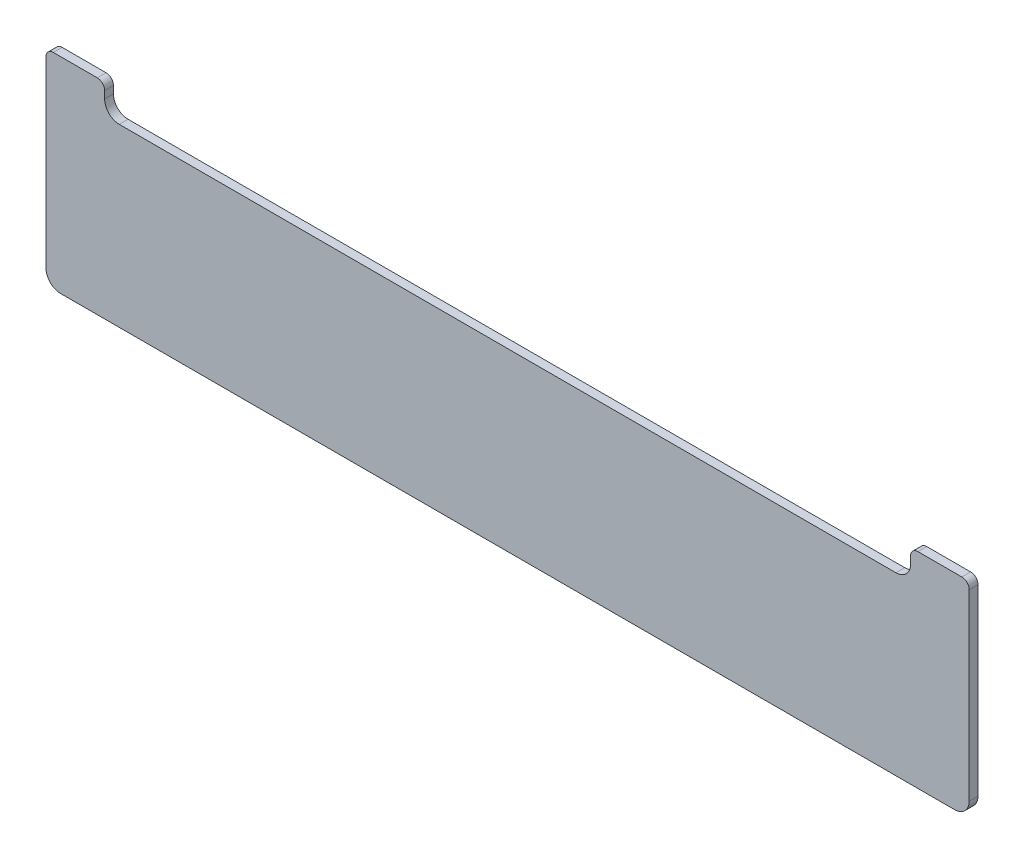
from build123d import *

# Parameters (mm, degrees)
SKETCH1_W           = 315
SKETCH1_H           = 70
BOSS_EXTRUDE1_DEPTH = 3
SKETCH2_W           = 275
SKETCH2_H           = 10
CUT_EXTRUDE1_DEPTH  = 3
FILLET1_R           = 5
FILLET2_R           = 2.5


with BuildPart() as part:
    # Sketch1 → Boss-Extrude1 (new body)
    with BuildSketch(Plane.XY):
        Rectangle(SKETCH1_W, SKETCH1_H)
    extrude(amount=BOSS_EXTRUDE1_DEPTH)

    # Sketch2 → Cut-Extrude1 (cut)
    with BuildSketch(Plane.XY.offset(3)):
        with Locations((0, 30)):
            Rectangle(SKETCH2_W, SKETCH2_H)
    extrude(amount=-CUT_EXTRUDE1_DEPTH, mode=Mode.SUBTRACT)

    # Fillet1
    fillet1_edges = [part.edges().sort_by_distance(p)[0] for p in [
        (-137.5, 25, 1.5),
        (137.5, 25, 1.5),
        (157.5, -35, 1.5),
        (-157.5, -35, 1.5),
    ]]
    fillet(fillet1_edges, radius=FILLET1_R)

    # Fillet2
    fillet2_edges = [part.edges().sort_by_distance(p)[0] for p in [
        (-137.5, 35, 1.5),
        (137.5, 35, 1.5),
        (-157.5, 35, 1.5),
        (157.5, 35, 1.5),
    ]]
    fillet(fillet2_edges, radius=FILLET2_R)


solid = part.part
